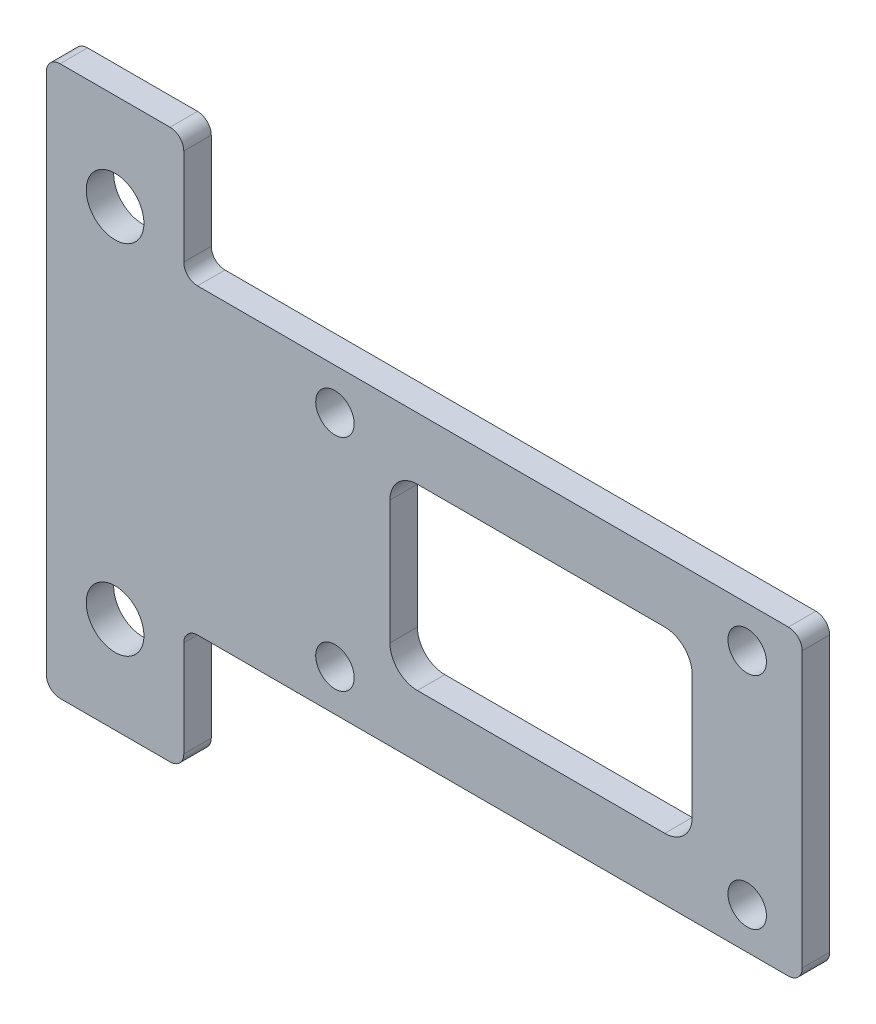
from build123d import *

# Parameters (mm, degrees)
SKETCH_1_R      = 2.1
SKETCH_1_R_2    = 1.4
EXTRUDE_1_DEPTH = 2
FILLET_1_R      = 1


with BuildPart() as part:
    # 草图1 → 凸台-拉伸1 (new body)
    with BuildSketch(Plane.XY):
        Polygon((87.5, -11), (87.5, -51), (97.5, -51), (97.5, -42), (142.5, -42), (142.5, -20), (97.5, -20), (97.5, -11), align=None)
        with Locations((92.5, -18)):
            Circle(SKETCH_1_R, mode=Mode.SUBTRACT)
        with Locations((92.5, -44)):
            Circle(SKETCH_1_R, mode=Mode.SUBTRACT)
        with Locations((138.5, -39)):
            Circle(SKETCH_1_R_2, mode=Mode.SUBTRACT)
        with Locations((108.5, -39)):
            Circle(SKETCH_1_R_2, mode=Mode.SUBTRACT)
        with Locations(Location((108.5, -23, 0), (0, 0, 180))):
            Circle(SKETCH_1_R_2, mode=Mode.SUBTRACT)
        with Locations(Location((138.5, -23, 0), (0, 0, 180))):
            Circle(SKETCH_1_R_2, mode=Mode.SUBTRACT)
        with BuildLine():
            Line((132.5, -37.5), (114.5, -37.5))
            ThreePointArc((114.5, -37.5), (113.085786438, -36.914213562), (112.5, -35.5))
            Line((112.5, -35.5), (112.5, -26.5))
            ThreePointArc((112.5, -26.5), (113.085786438, -25.085786438), (114.5, -24.5))
            Line((114.5, -24.5), (132.5, -24.5))
            ThreePointArc((132.5, -24.5), (133.914213562, -25.085786438), (134.5, -26.5))
            Line((134.5, -26.5), (134.5, -35.5))
            ThreePointArc((134.5, -35.5), (133.914213562, -36.914213562), (132.5, -37.5))
        make_face(mode=Mode.SUBTRACT)
    extrude(amount=EXTRUDE_1_DEPTH)

    # 圆角1
    fillet_1_edges = [part.edges().sort_by_distance(p)[0] for p in [
        (97.5, -11, 1),
        (97.5, -20, 1),
        (142.5, -20, 1),
        (142.5, -42, 1),
        (97.5, -42, 1),
        (97.5, -51, 1),
        (87.5, -51, 1),
        (87.5, -11, 1),
    ]]
    fillet(fillet_1_edges, radius=FILLET_1_R)


solid = part.part
